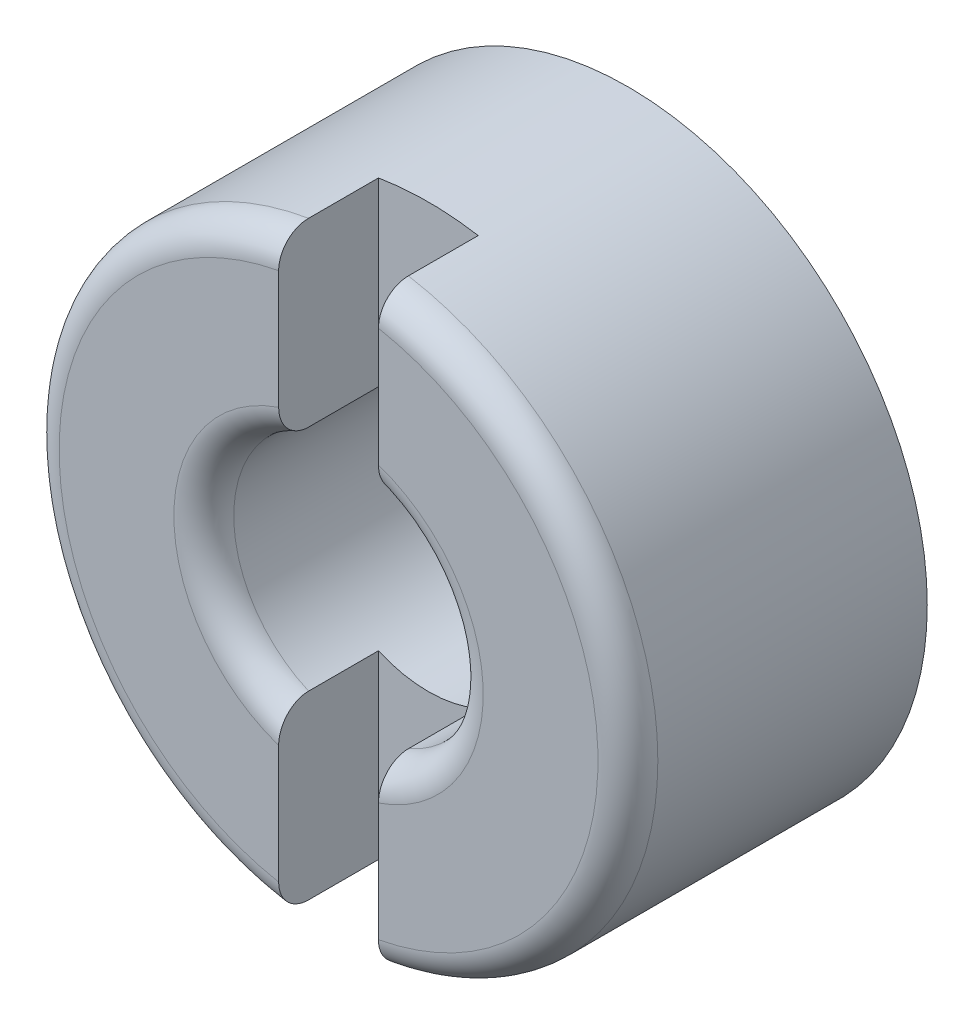
from build123d import *

# Parameters (mm, degrees)
SKETCH1_R           = 3
BOSS_EXTRUDE1_DEPTH = 3
SKETCH2_R           = 1.25
CUT_EXTRUDE1_DEPTH  = 6.196152423
FILLET1_R           = 0.3
SKETCH3_W           = 1
SKETCH3_H           = 8
CUT_EXTRUDE3_DEPTH  = 1


with BuildPart() as part:
    # Sketch1 → Boss-Extrude1 (new body)
    with BuildSketch(Plane.XY):
        Circle(SKETCH1_R)
    extrude(amount=BOSS_EXTRUDE1_DEPTH)

    # Sketch2 → Cut-Extrude1 (cut, through all)
    with BuildSketch(Plane.XY.offset(3)):
        Circle(SKETCH2_R)
    extrude(amount=-CUT_EXTRUDE1_DEPTH, mode=Mode.SUBTRACT)

    # Fillet1
    fillet1_edges = [part.edges().sort_by_distance(p)[0] for p in [
        (-3, 0, 3),
        (-1.25, 0, 0),
        (-1.25, 0, 3),
    ]]
    fillet(fillet1_edges, radius=FILLET1_R)

    # Sketch3 → Cut-Extrude3 (cut)
    with BuildSketch(Plane.XY.offset(3)):
        Rectangle(SKETCH3_W, SKETCH3_H)
    extrude(amount=-CUT_EXTRUDE3_DEPTH, mode=Mode.SUBTRACT)


solid = part.part
